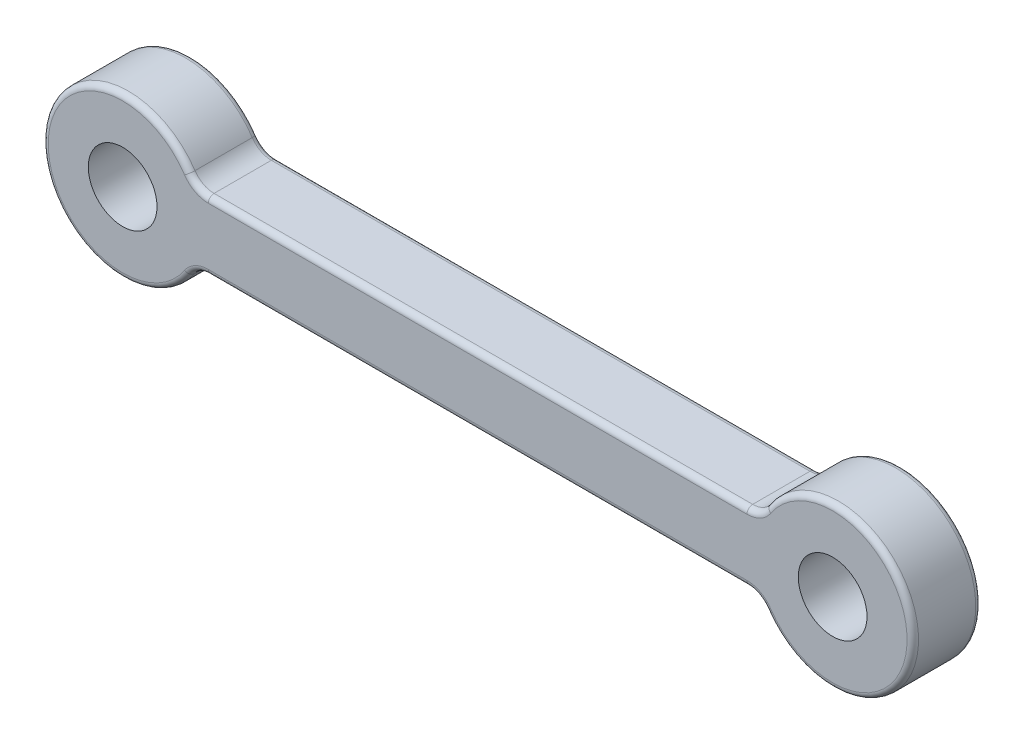
from build123d import *

# Parameters (mm, degrees)
SKETCH3_R           = 1.5
BOSS_EXTRUDE2_DEPTH = 3
FILLET1_R           = 1
FILLET2_R           = 0.25


with BuildPart() as part:
    # Sketch3 → Boss-Extrude2 (new body)
    # profile 1 of 5: a face of its own
    with BuildSketch(Plane.XY):
        with BuildLine():
            ThreePointArc((3.16227766, 1.5), (-3.5, 0), (3.16227766, -1.5))
            Line((3.16227766, -1.5), (3.16227766, 1.5))
        make_face()
        Circle(SKETCH3_R, mode=Mode.SUBTRACT)
    # profile 2 of 5: a face of its own
    with BuildSketch(Plane.XY):
        with BuildLine():
            Line((3.16227766, 1.5), (3.16227766, -1.5))
            ThreePointArc((3.16227766, -1.5), (3.414525722, -0.768774411), (3.5, 0))
            ThreePointArc((3.5, 0), (3.414525722, 0.768774411), (3.16227766, 1.5))
        make_face()
    # profile 3 of 5: a face of its own
    with BuildSketch(Plane.XY):
        with BuildLine():
            Line((3.16227766, -1.5), (27.83772234, -1.5))
            ThreePointArc((27.83772234, -1.5), (27.5, 0), (27.83772234, 1.5))
            Line((27.83772234, 1.5), (3.16227766, 1.5))
            ThreePointArc((3.16227766, 1.5), (3.414525722, 0.768774411), (3.5, 0))
            ThreePointArc((3.5, 0), (3.414525722, -0.768774411), (3.16227766, -1.5))
        make_face()
    # profile 4 of 5: a face of its own
    with BuildSketch(Plane.XY):
        with BuildLine():
            Line((27.83772234, 1.5), (27.83772234, -1.5))
            ThreePointArc((27.83772234, -1.5), (31.768774411, -3.414525722), (34.5, 0))
            ThreePointArc((34.5, 0), (31.768774411, 3.414525722), (27.83772234, 1.5))
        make_face()
        with Locations((31, 0)):
            Circle(SKETCH3_R, mode=Mode.SUBTRACT)
    # profile 5 of 5: a face of its own
    with BuildSketch(Plane.XY):
        with BuildLine():
            ThreePointArc((27.83772234, 1.5), (27.5, 0), (27.83772234, -1.5))
            Line((27.83772234, -1.5), (27.83772234, 1.5))
        make_face()
    extrude(amount=BOSS_EXTRUDE2_DEPTH)

    # Fillet1
    fillet1_edges = [part.edges().sort_by_distance(p)[0] for p in [
        (3.16227766, 1.5, 1.5),
        (27.83772234, 1.5, 1.5),
        (27.83772234, -1.5, 1.5),
        (3.16227766, -1.5, 1.5),
    ]]
    fillet(fillet1_edges, radius=FILLET1_R)

    # Fillet2
    fillet2_edges = [part.edges().sort_by_distance(p)[0] for p in [
        (15.5, -1.5, 0),
        (15.5, -1.5, 3),
        (-3.5, 0, 0),
        (-3.5, 0, 3),
        (15.5, 1.5, 0),
        (15.5, 1.5, 3),
        (34.5, 0, 0),
        (34.5, 0, 3),
        (3.270252866, -1.618082896, 0),
        (3.270252866, -1.618082896, 3),
        (3.270252866, 1.618082896, 0),
        (3.270252866, 1.618082896, 3),
        (27.729747134, 1.618082896, 0),
        (27.729747134, 1.618082896, 3),
        (27.729747134, -1.618082896, 0),
        (27.729747134, -1.618082896, 3),
    ]]
    fillet(fillet2_edges, radius=FILLET2_R)


solid = part.part
